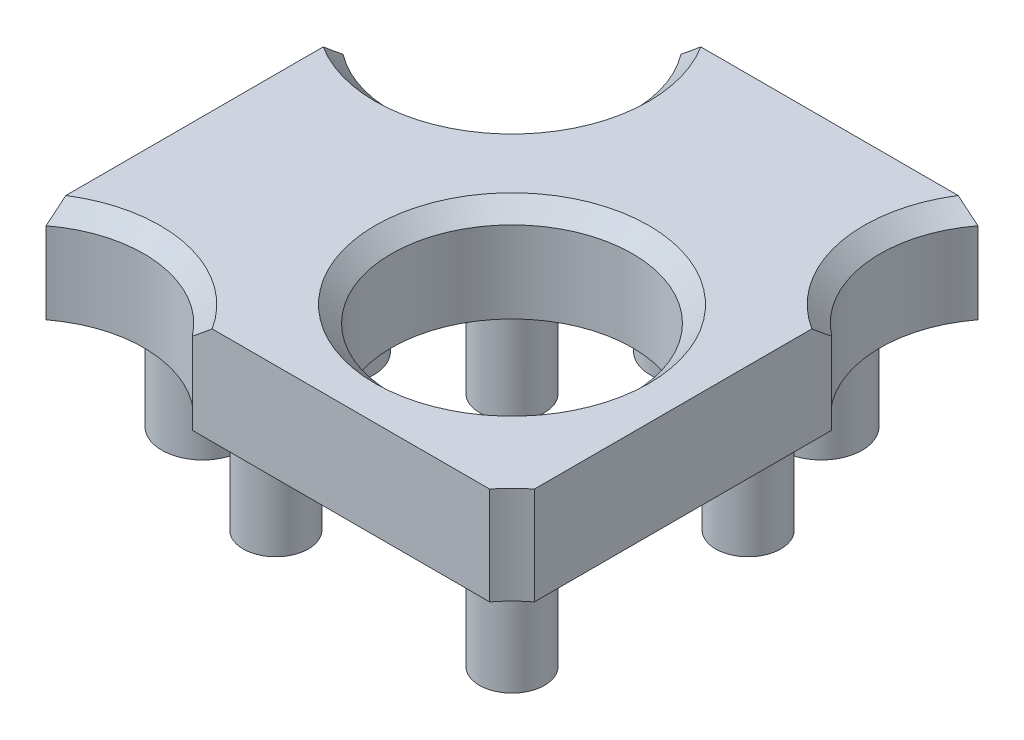
from build123d import *

# Parameters (mm, degrees)
SKETCH1_W                   = 21
SKETCH1_H                   = 21
BOSS_EXTRUDE1_DEPTH         = 12
CUT_EXTRUDE1_REACH          = 21.092
SKETCH2_R                   = 7.4
SKETCH3_W                   = 21
SKETCH3_H                   = 6
BOSS_EXTRUDE2_DEPTH         = 8.99
SKETCH4_W                   = 21
SKETCH4_H                   = 6
BOSS_EXTRUDE3_DEPTH         = 8.99
SKETCH5_R                   = 2.5
BOSS_EXTRUDE4_DEPTH         = 6
CUT_EXTRUDE2_REACH          = 24.937
SKETCH6_R                   = 2.6
CIRPATTERN1_COUNT           = 2
CIRPATTERN1_ANGLE           = 90
CIRPATTERN1_COPY_1_SKETCH_R = 2.5
CIRPATTERN1_COPY_1_DEPTH    = 6
CIRPATTERN1_COPY_2_REACH    = 24.937
CIRPATTERN1_COPY_2_SKETCH_R = 2.6
SKETCH7_W                   = 31.659066887
SKETCH7_H                   = 31.46982372
CUT_EXTRUDE3_DEPTH          = 11
FILLET1_R                   = 7
SKETCH9_R                   = 7.4
CUT_EXTRUDE4_DEPTH          = 11
CIRPATTERN2_COUNT           = 4
SKETCH10_R                  = 2
BOSS_EXTRUDE5_DEPTH         = 6
CIRPATTERN3_COUNT           = 4
CHAMFER1_SIZE               = 1
CHAMFER2_SIZE               = 1


with BuildPart() as part:
    # Sketch1 → Boss-Extrude1 (new body)
    with BuildSketch(Plane(origin=(0, 0, 0), x_dir=(1, 0, 0), z_dir=(0, 1, 0))):
        Rectangle(SKETCH1_W, SKETCH1_H)
    extrude(amount=BOSS_EXTRUDE1_DEPTH)

    # Sketch2 → Cut-Extrude1 (cut, up to next)
    with BuildSketch(Plane(origin=(0, 12, 0), x_dir=(1, 0, 0), z_dir=(0, 1, 0)), mode=Mode.PRIVATE) as cut_extrude1_sk1:
        with Locations(Location((0, 0, 0), (0, 0, 270))):
            Circle(SKETCH2_R)
    cut_extrude1_tool1 = extrude(cut_extrude1_sk1.sketch, amount=-CUT_EXTRUDE1_REACH, mode=Mode.PRIVATE) & part.part
    add(cut_extrude1_tool1.solids().sort_by_distance((0, 12, 0))[0], mode=Mode.SUBTRACT)

    # Sketch3 → Boss-Extrude2 (add)
    with BuildSketch(Plane.XY.offset(10.5)):
        with Locations((0, 3)):
            Rectangle(SKETCH3_W, SKETCH3_H)
    boss_extrude2 = extrude(amount=BOSS_EXTRUDE2_DEPTH)

    # Sketch4 → Boss-Extrude3 (add)
    with BuildSketch(Plane(origin=(0, 0, -10.5), x_dir=(-1, 0, 0), z_dir=(0, 0, -1))):
        with Locations((0, 9)):
            Rectangle(SKETCH4_W, SKETCH4_H)
    boss_extrude3 = extrude(amount=BOSS_EXTRUDE3_DEPTH)

    # Sketch5 → Boss-Extrude4 (add)
    with BuildSketch(Plane.XZ.offset(-6)):
        with Locations(Location((4, -14.995, 0), (0, 0, 90))):
            Circle(SKETCH5_R)
    boss_extrude4 = extrude(amount=BOSS_EXTRUDE4_DEPTH)

    # Sketch6 → Cut-Extrude2 (cut, up to next)
    with BuildSketch(Plane(origin=(0, 6, 0), x_dir=(1, 0, 0), z_dir=(0, 1, 0)), mode=Mode.PRIVATE) as cut_extrude2_sk1:
        with Locations(Location((4.5, -14.995, 0), (0, 0, 270))):
            Circle(SKETCH6_R)
    cut_extrude2_tool1 = extrude(cut_extrude2_sk1.sketch, amount=-CUT_EXTRUDE2_REACH, mode=Mode.PRIVATE) & part.part
    cut_extrude2 = cut_extrude2_tool1.solids().sort_by_distance((4.5, 6, 14.995))[0]
    add(cut_extrude2, mode=Mode.SUBTRACT)

    # Mirror1: Boss-Extrude4 across plane
    add(boss_extrude4.mirror(Plane(origin=(0, 0, 0), x_dir=(0, 0, 1), z_dir=(1, 0, 0))))

    # Mirror2: Cut-Extrude2 across plane
    add(cut_extrude2.mirror(Plane(origin=(0, 0, 0), x_dir=(0, 0, 1), z_dir=(1, 0, 0))), mode=Mode.SUBTRACT)

    # CirPattern1: Boss-Extrude2, Boss-Extrude3, Boss-Extrude4, Cut-Extrude2 ×2 about axis
    cirpattern1_axis = Axis((0, 0, 0), (0, 1, 0))
    add([boss_extrude2.rotate(cirpattern1_axis, i * CIRPATTERN1_ANGLE / (CIRPATTERN1_COUNT - 1)) for i in range(1, CIRPATTERN1_COUNT)])
    add([boss_extrude3.rotate(cirpattern1_axis, i * CIRPATTERN1_ANGLE / (CIRPATTERN1_COUNT - 1)) for i in range(1, CIRPATTERN1_COUNT)])
    add([boss_extrude4.rotate(cirpattern1_axis, i * CIRPATTERN1_ANGLE / (CIRPATTERN1_COUNT - 1)) for i in range(1, CIRPATTERN1_COUNT)])
    add([cut_extrude2.rotate(cirpattern1_axis, i * CIRPATTERN1_ANGLE / (CIRPATTERN1_COUNT - 1)) for i in range(1, CIRPATTERN1_COUNT)], mode=Mode.SUBTRACT)

    # CirPattern1 copy 1 sketch → CirPattern1 copy 1 (add)
    with BuildSketch(Plane(origin=(0, 6, 0), x_dir=(0, 0, 1), z_dir=(0, -1, 0))):
        with Locations((4, 14.995)):
            Circle(CIRPATTERN1_COPY_1_SKETCH_R)
    extrude(amount=CIRPATTERN1_COPY_1_DEPTH)

    # CirPattern1 copy 2 sketch → CirPattern1 copy 2 (cut, up to next)
    with BuildSketch(Plane.ZX.offset(6), mode=Mode.PRIVATE) as cirpattern1_copy_2_sk1:
        with Locations((4.5, 14.995)):
            Circle(CIRPATTERN1_COPY_2_SKETCH_R)
    cirpattern1_copy_2_tool1 = extrude(cirpattern1_copy_2_sk1.sketch, amount=-CIRPATTERN1_COPY_2_REACH, mode=Mode.PRIVATE) & part.part
    add(cirpattern1_copy_2_tool1.solids().sort_by_distance((14.995, 6, 4.5))[0], mode=Mode.SUBTRACT)

    # Sketch7 → Cut-Extrude3 (cut)
    with BuildSketch(Plane.XZ.offset(-6)):
        with Locations((5.329533444, 5.23491186)):
            Rectangle(SKETCH7_W, SKETCH7_H)
    extrude(amount=CUT_EXTRUDE3_DEPTH, mode=Mode.SUBTRACT)

    # Fillet1
    fillet1_edges = [part.edges().sort_by_distance(p)[0] for p in [
        (-10.5, 9, -10.5),
    ]]
    fillet(fillet1_edges, radius=FILLET1_R)

    # Sketch9 → Cut-Extrude4 (cut)
    with BuildSketch(Plane(origin=(0, 12, 0), x_dir=(1, 0, 0), z_dir=(0, 1, 0))):
        with Locations((-15, 15)):
            Circle(SKETCH9_R)
    cut_extrude4 = extrude(amount=-CUT_EXTRUDE4_DEPTH, mode=Mode.SUBTRACT)

    # CirPattern2: Cut-Extrude4 ×4 about axis
    cirpattern2_axis = Axis((0, 0, 0), (0, 1, 0))
    for i in range(1, CIRPATTERN2_COUNT):
        add(cut_extrude4.rotate(cirpattern2_axis, i * 360 / CIRPATTERN2_COUNT), mode=Mode.SUBTRACT)

    # Sketch10 → Boss-Extrude5 (add)
    with BuildSketch(Plane.XZ.offset(-6)):
        with Locations(Location((-7.25, 7.25, 0), (0, 0, 90))):
            Circle(SKETCH10_R)
    boss_extrude5 = extrude(amount=BOSS_EXTRUDE5_DEPTH)

    # CirPattern3: Boss-Extrude5 ×4 about axis
    cirpattern3_axis = Axis((0, 0, 0), (0, 1, 0))
    for i in range(1, CIRPATTERN3_COUNT):
        add(boss_extrude5.rotate(cirpattern3_axis, i * 360 / CIRPATTERN3_COUNT))

    # Chamfer1
    chamfer1_edges = [part.edges().sort_by_distance(p)[0] for p in [
        (0, 12, -7.4),
    ]]
    chamfer(chamfer1_edges, length=CHAMFER1_SIZE)

    # Chamfer2
    chamfer2_edges = [part.edges().sort_by_distance(p)[0] for p in [
        (-9.767409819, 12, -9.767409819),
        (7.664935028, 12, -14.02182729),
        (-14.02182729, 12, 7.664935028),
    ]]
    chamfer(chamfer2_edges, length=CHAMFER2_SIZE)


solid = part.part
